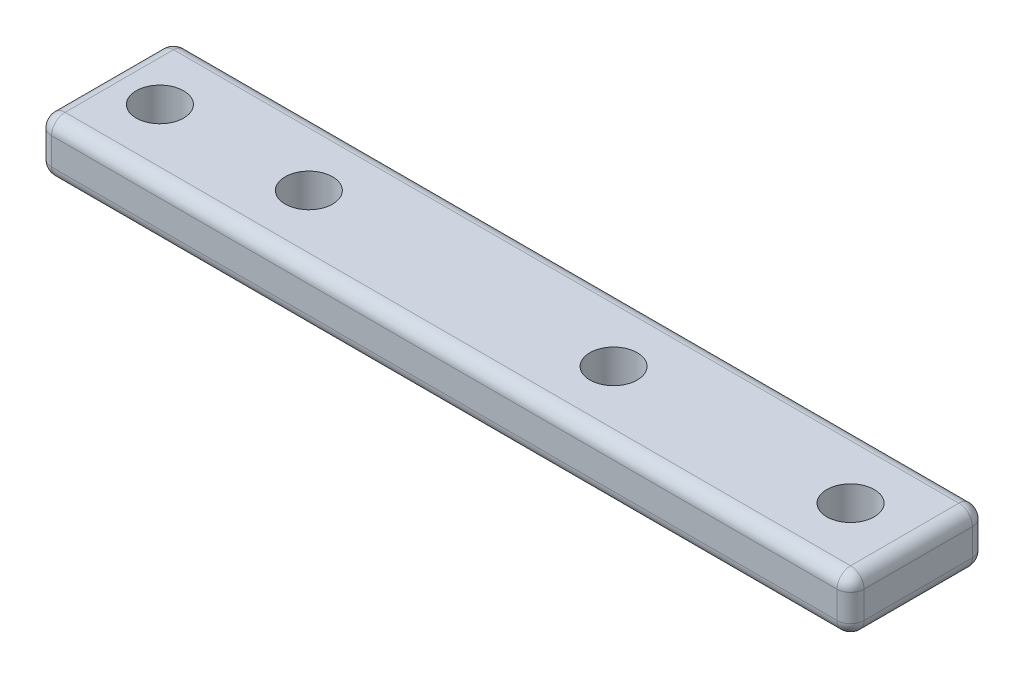
from build123d import *

# Parameters (mm, degrees)
SKETCH1_W           = 60
SKETCH1_H           = 10
BOSS_EXTRUDE1_DEPTH = 4
SKETCH2_R           = 1.75
CUT_EXTRUDE1_DEPTH  = 4
FILLET1_R           = 1


with BuildPart() as part:
    # Sketch1 → Boss-Extrude1 (new body)
    with BuildSketch(Plane(origin=(0, 0, 0), x_dir=(1, 0, 0), z_dir=(0, 1, 0))):
        Rectangle(SKETCH1_W, SKETCH1_H)
    extrude(amount=BOSS_EXTRUDE1_DEPTH)

    # Sketch2 → Cut-Extrude1 (cut)
    with BuildSketch(Plane(origin=(0, 4, 0), x_dir=(1, 0, 0), z_dir=(0, 1, 0))):
        with Locations(Location((-26, 0, 0), (0, 0, 270))):
            Circle(SKETCH2_R)
        with Locations(Location((7.5, 0, 0), (0, 0, 270))):
            Circle(SKETCH2_R)
        with Locations(Location((25, 0, 0), (0, 0, 270))):
            Circle(SKETCH2_R)
        with Locations(Location((-15, 0, 0), (0, 0, 270))):
            Circle(SKETCH2_R)
    extrude(amount=-CUT_EXTRUDE1_DEPTH, mode=Mode.SUBTRACT)

    # Fillet1
    fillet1_edges = [part.edges().sort_by_distance(p)[0] for p in [
        (-30, 4, 0),
        (0, 4, 5),
        (30, 4, 0),
        (0, 0, 5),
        (-30, 0, 0),
        (0, 0, -5),
        (30, 0, 0),
        (30, 2, 5),
        (-30, 2, 5),
        (-30, 2, -5),
        (30, 2, -5),
        (0, 4, -5),
    ]]
    fillet(fillet1_edges, radius=FILLET1_R)


solid = part.part
